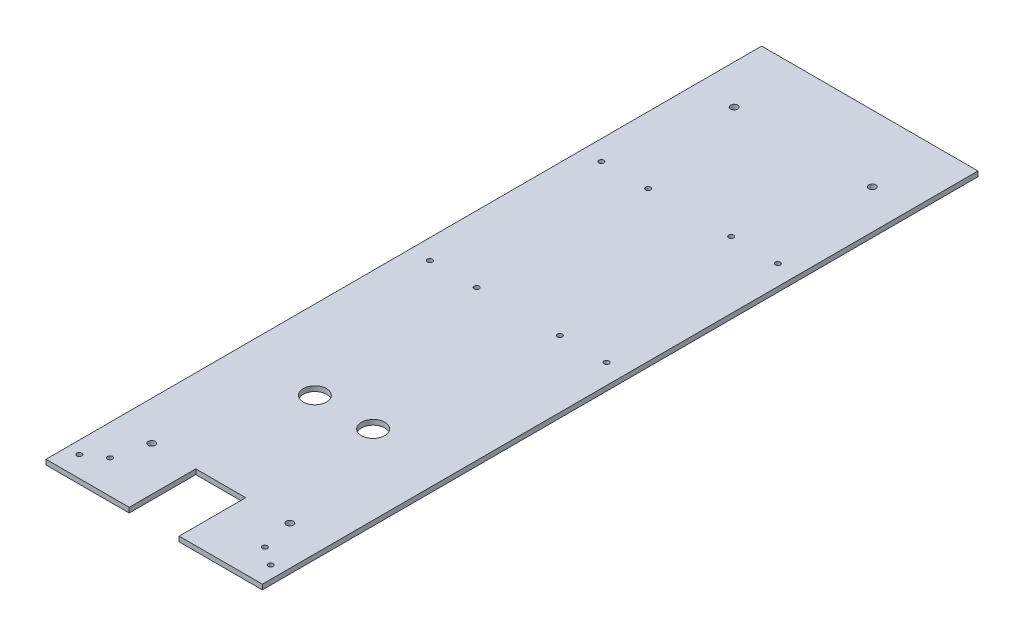
from build123d import *

# Parameters (mm, degrees)
SKETCH1_W           = 130
SKETCH1_H           = 430
BOSS_EXTRUDE1_DEPTH = 3
SKETCH2_W           = 30
SKETCH2_H           = 40
CUT_EXTRUDE1_DEPTH  = 10
SKETCH3_R           = 1.5
SKETCH3_R_2         = 2.1
CUT_EXTRUDE2_DEPTH  = 10
SKETCH4_R           = 7
CUT_EXTRUDE3_DEPTH  = 10


with BuildPart() as part:
    # Sketch1 → Boss-Extrude1 (new body)
    with BuildSketch(Plane(origin=(0, 0, 0), x_dir=(1, 0, 0), z_dir=(0, 1, 0))):
        Rectangle(SKETCH1_W, SKETCH1_H)
    extrude(amount=BOSS_EXTRUDE1_DEPTH)

    # Sketch2 → Cut-Extrude1 (cut)
    with BuildSketch(Plane(origin=(0, 3, 0), x_dir=(1, 0, 0), z_dir=(0, 1, 0))):
        with Locations((0, -195)):
            Rectangle(SKETCH2_W, SKETCH2_H)
    extrude(amount=-CUT_EXTRUDE1_DEPTH, mode=Mode.SUBTRACT)

    # Sketch3 → Cut-Extrude2 (cut)
    with BuildSketch(Plane.XZ):
        with Locations(Location((-53.05, -3.75, 0), (0, 0, 270))):
            Circle(SKETCH3_R)
        with Locations(Location((-46.5, 195, 0), (0, 0, 270))):
            Circle(SKETCH3_R)
        with Locations(Location((-24.95, -3.75, 0), (0, 0, 270))):
            Circle(SKETCH3_R)
        with Locations(Location((-53.05, -106.75, 0), (0, 0, 270))):
            Circle(SKETCH3_R)
        with Locations(Location((46.5, 195, 0), (0, 0, 270))):
            Circle(SKETCH3_R)
        with Locations(Location((-24.95, -106.75, 0), (0, 0, 270))):
            Circle(SKETCH3_R)
        with Locations(Location((24.95, -106.75, 0), (0, 0, 90))):
            Circle(SKETCH3_R)
        with Locations(Location((57.5, 202.5, 0), (0, 0, 270))):
            Circle(SKETCH3_R)
        with Locations(Location((53.05, -106.75, 0), (0, 0, 90))):
            Circle(SKETCH3_R)
        with Locations(Location((24.95, -3.75, 0), (0, 0, 90))):
            Circle(SKETCH3_R)
        with Locations(Location((-57.5, 202.5, 0), (0, 0, 270))):
            Circle(SKETCH3_R)
        with Locations(Location((53.05, -3.75, 0), (0, 0, 90))):
            Circle(SKETCH3_R)
        with Locations(Location((-41.5, 175, 0), (0, 0, 270))):
            Circle(SKETCH3_R_2)
        with Locations(Location((41.5, 175, 0), (0, 0, 270))):
            Circle(SKETCH3_R_2)
        with Locations(Location((41.5, -175, 0), (0, 0, 270))):
            Circle(SKETCH3_R_2)
        with Locations(Location((-41.5, -175, 0), (0, 0, 270))):
            Circle(SKETCH3_R_2)
    extrude(amount=-CUT_EXTRUDE2_DEPTH, mode=Mode.SUBTRACT)

    # Sketch4 → Cut-Extrude3 (cut)
    with BuildSketch(Plane.XZ):
        with Locations(Location((-17.5, 100.952208061, 0), (0, 0, 270))):
            Circle(SKETCH4_R)
        with Locations(Location((17.5, 100.952208061, 0), (0, 0, 270))):
            Circle(SKETCH4_R)
    extrude(amount=-CUT_EXTRUDE3_DEPTH, mode=Mode.SUBTRACT)


solid = part.part
